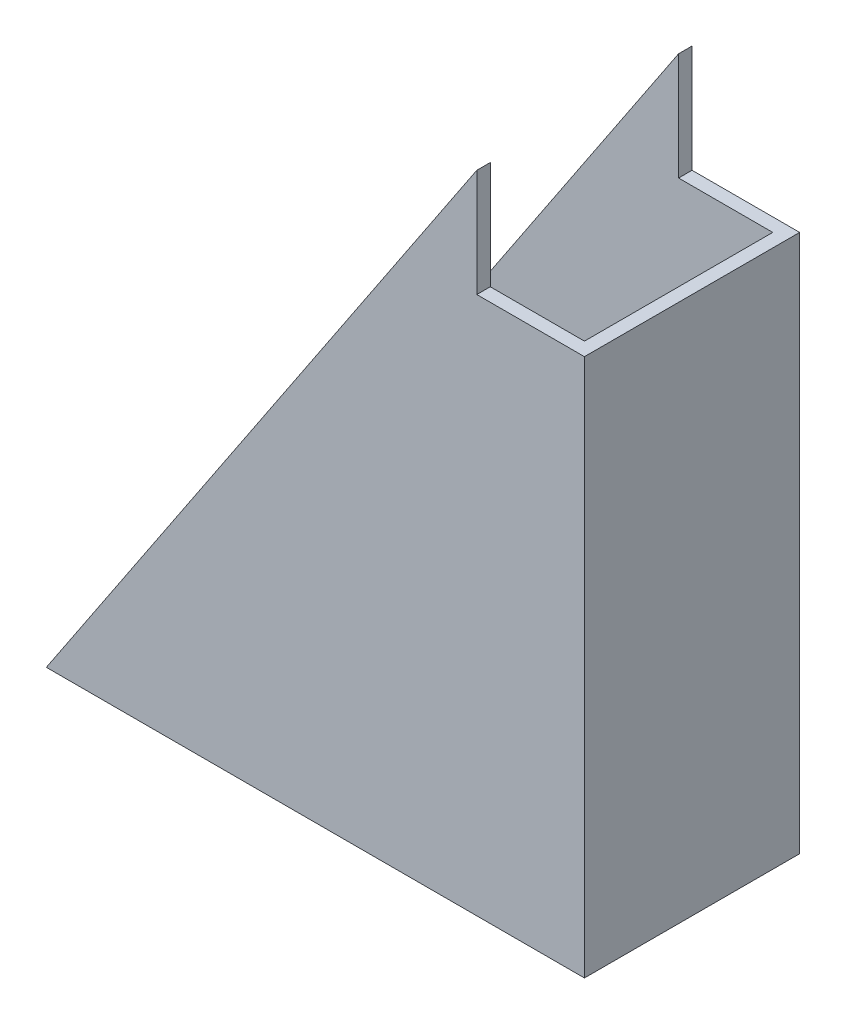
from build123d import *

# Parameters (mm, degrees)
SKETCH1_W           = 63.5
SKETCH1_H           = 25.4
SKETCH1_W_2         = 60.325
SKETCH1_H_2         = 22.225
BOSS_EXTRUDE1_DEPTH = 76.2
SKETCH2_W           = 12.7
SKETCH2_H           = 12.7
CUT_EXTRUDE1_DEPTH  = 515.310800975


with BuildPart() as part:
    # Sketch1 → Boss-Extrude1 (new body)
    with BuildSketch(Plane(origin=(0, 25.4, 0), x_dir=(1, 0, 0), z_dir=(0, 1, 0))):
        with Locations((298.45, -368.3)):
            Rectangle(SKETCH1_W, SKETCH1_H)
        with Locations((298.45, -368.3)):
            Rectangle(SKETCH1_W_2, SKETCH1_H_2, mode=Mode.SUBTRACT)
    extrude(amount=BOSS_EXTRUDE1_DEPTH)

    # Sketch2 → Cut-Extrude1 (cut, through all)
    with BuildSketch(Plane.XY):
        Polygon((266.7, 101.6), (317.5, 101.6), (266.7, 25.4), align=None)
        with Locations((323.85, 95.25)):
            Rectangle(SKETCH2_W, SKETCH2_H)
    extrude(amount=CUT_EXTRUDE1_DEPTH, mode=Mode.SUBTRACT)


solid = part.part
